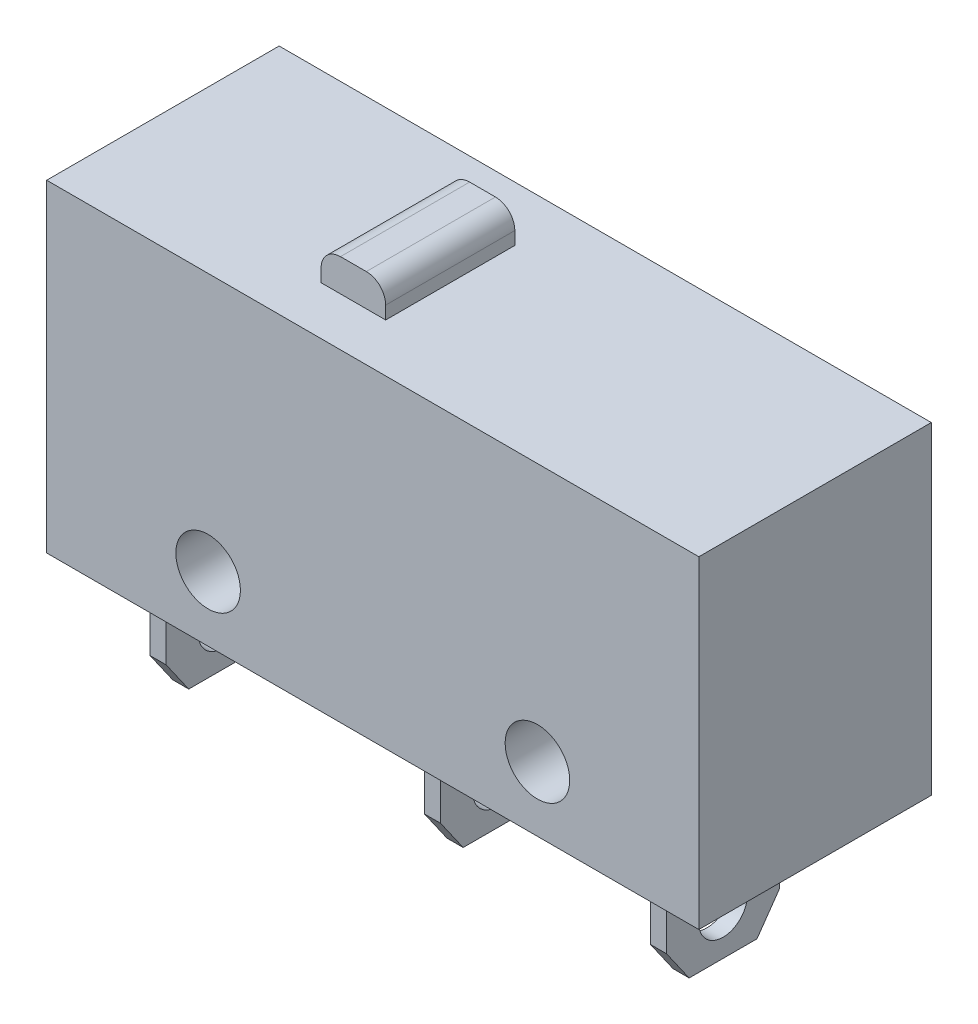
from build123d import *
from OCP.BRepFilletAPI import BRepFilletAPI_MakeChamfer

# Parameters (mm, degrees)
SKETCH_1_W          = 20.2
SKETCH_1_H          = 7.2
EXTRUDE_1_DEPTH     = 10
SKETCH_2_W          = 0.5
SKETCH_2_H          = 3.5
EXTRUDE_2_DEPTH     = 4
CUT_EXTRUDE_1_REACH = 23.64
SKETCH_3_R          = 0.75
CHAMFER_1_SIZE      = 1
CHAMFER_1_SIZE2     = 0.700207538
SKETCH_4_R          = 1
CUT_EXTRUDE_2_DEPTH = 16.932670837
SKETCH_5_W          = 2
SKETCH_5_H          = 4
EXTRUDE_3_DEPTH     = 1
FILLET_1_R          = 0.6


with BuildPart() as part:
    # Эскиз1 → Бобышка-Вытянуть1 (new body)
    with BuildSketch(Plane(origin=(0, 0, 0), x_dir=(1, 0, 0), z_dir=(0, 1, 0))):
        Rectangle(SKETCH_1_W, SKETCH_1_H)
    extrude(amount=EXTRUDE_1_DEPTH)

    # Эскиз2 → Бобышка-Вытянуть2 (add)
    with BuildSketch(Plane(origin=(0, 0, 0), x_dir=(-1, 0, 0), z_dir=(0, -1, 0))):
        with Locations((-7, 0)):
            Rectangle(SKETCH_2_W, SKETCH_2_H)
        Rectangle(SKETCH_2_W, SKETCH_2_H)
        with Locations((8.5, 0)):
            Rectangle(SKETCH_2_W, SKETCH_2_H)
    extrude(amount=EXTRUDE_2_DEPTH)

    # Вырез-Вытянуть1: up to this face of the body (flat: up to its plane)
    cut_extrude_1_end = Plane(part.part.faces().sort_by_distance((7.25, -2, 0))[0])
    # Эскиз3 → Вырез-Вытянуть1 (cut, up to the picked face)
    with BuildSketch(Plane.ZY.offset(8.75), mode=Mode.PRIVATE) as cut_extrude_1_sk1:
        with Locations((0, -2.680856865)):
            Circle(SKETCH_3_R)
    cut_extrude_1_tool1 = split(extrude(cut_extrude_1_sk1.sketch, amount=-CUT_EXTRUDE_1_REACH, mode=Mode.PRIVATE), bisect_by=cut_extrude_1_end, keep=Keep.BOTH, mode=Mode.PRIVATE)
    add(cut_extrude_1_tool1.solids().sort_by(Axis((-8.75, -2.680857, 0), (1, 0, 0)))[0], mode=Mode.SUBTRACT)

    # Фаска1: one chamfer whose edges measure the first distance from different faces: ONE call of the kernel's chamfer builder (chamfer() names one face for all edges)
    chamfer_1_edges_1 = [part.edges().sort_by_distance(p)[0] for p in [
        (0, -4, 1.75),
    ]]
    chamfer_1_side_1 = [part.faces().sort_by_distance(p)[0] for p in [
        (0, -2, 1.75),
    ]]
    chamfer_1_edges_2 = [part.edges().sort_by_distance(p)[0] for p in [
        (0, -4, -1.75),
    ]]
    chamfer_1_side_2 = [part.faces().sort_by_distance(p)[0] for p in [
        (0, -2, -1.75),
    ]]
    chamfer_1_edges_3 = [part.edges().sort_by_distance(p)[0] for p in [
        (7, -4, -1.75),
    ]]
    chamfer_1_side_3 = [part.faces().sort_by_distance(p)[0] for p in [
        (7, -2, -1.75),
    ]]
    chamfer_1_edges_4 = [part.edges().sort_by_distance(p)[0] for p in [
        (7, -4, 1.75),
    ]]
    chamfer_1_side_4 = [part.faces().sort_by_distance(p)[0] for p in [
        (7, -2, 1.75),
    ]]
    chamfer_1_edges_5 = [part.edges().sort_by_distance(p)[0] for p in [
        (-8.5, -4, -1.75),
    ]]
    chamfer_1_side_5 = [part.faces().sort_by_distance(p)[0] for p in [
        (-8.5, -2, -1.75),
    ]]
    chamfer_1_edges_6 = [part.edges().sort_by_distance(p)[0] for p in [
        (-8.5, -4, 1.75),
    ]]
    chamfer_1_side_6 = [part.faces().sort_by_distance(p)[0] for p in [
        (-8.5, -2, 1.75),
    ]]
    chamfer_1 = BRepFilletAPI_MakeChamfer(part.part.solid().wrapped)
    for e in chamfer_1_edges_1:
        chamfer_1.Add(CHAMFER_1_SIZE, CHAMFER_1_SIZE2, e.wrapped, chamfer_1_side_1[0].wrapped)  # the first distance lies on this face
    for e in chamfer_1_edges_2:
        chamfer_1.Add(CHAMFER_1_SIZE, CHAMFER_1_SIZE2, e.wrapped, chamfer_1_side_2[0].wrapped)  # the first distance lies on this face
    for e in chamfer_1_edges_3:
        chamfer_1.Add(CHAMFER_1_SIZE, CHAMFER_1_SIZE2, e.wrapped, chamfer_1_side_3[0].wrapped)  # the first distance lies on this face
    for e in chamfer_1_edges_4:
        chamfer_1.Add(CHAMFER_1_SIZE, CHAMFER_1_SIZE2, e.wrapped, chamfer_1_side_4[0].wrapped)  # the first distance lies on this face
    for e in chamfer_1_edges_5:
        chamfer_1.Add(CHAMFER_1_SIZE, CHAMFER_1_SIZE2, e.wrapped, chamfer_1_side_5[0].wrapped)  # the first distance lies on this face
    for e in chamfer_1_edges_6:
        chamfer_1.Add(CHAMFER_1_SIZE, CHAMFER_1_SIZE2, e.wrapped, chamfer_1_side_6[0].wrapped)  # the first distance lies on this face
    add(Compound.cast(chamfer_1.Shape()), mode=Mode.REPLACE)

    # Эскиз4 → Вырез-Вытянуть2 (cut, through all)
    with BuildSketch(Plane(origin=(0, 0, -3.6), x_dir=(-1, 0, 0), z_dir=(0, 0, -1))):
        with Locations((-5.1, 2)):
            Circle(SKETCH_4_R)
        with Locations(Location((5.1, 2, 0), (0, 0, 180))):
            Circle(SKETCH_4_R)
    extrude(amount=-CUT_EXTRUDE_2_DEPTH, mode=Mode.SUBTRACT)

    # Эскиз5 → Бобышка-Вытянуть3 (add)
    with BuildSketch(Plane(origin=(0, 10, 0), x_dir=(1, 0, 0), z_dir=(0, 1, 0))):
        with Locations((-2.1, -0.1)):
            Rectangle(SKETCH_5_W, SKETCH_5_H)
    extrude(amount=EXTRUDE_3_DEPTH)

    # Скругление1
    fillet_1_edges = [part.edges().sort_by_distance(p)[0] for p in [
        (-3.1, 11, 0.1),
        (-1.1, 11, 0.1),
    ]]
    fillet(fillet_1_edges, radius=FILLET_1_R)


solid = part.part
